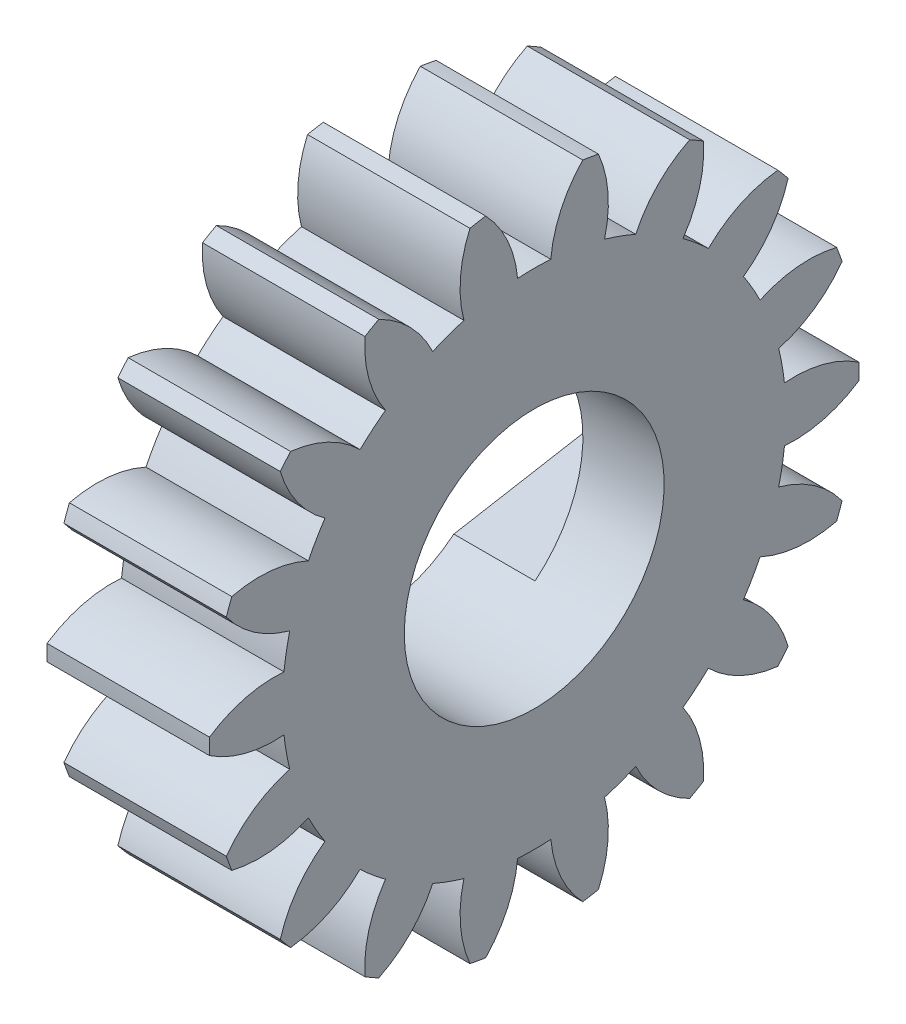
from build123d import *

# Parameters (mm, degrees)
BASPROSKE_W         = 5
BASPROSKE_H         = 10
TOOTHCUT_DEPTH      = 16
TEETHCUTS_COUNT     = 18
TEETHCUTS_ANGLE     = 340
BORSKE_R            = 4
BORE_DEPTH          = 50.0000508
CUT_EXTRUDE_1_DEPTH = 2.5


with BuildPart() as part:
    # BasProSke → Base-Revolve (revolve)
    with BuildSketch(Plane(origin=(0, 0, 0), x_dir=(1, 0, 0), z_dir=(0, 1, 0)), mode=Mode.PRIVATE) as base_revolve_sk:
        with Locations((2.5, 5)):
            Rectangle(BASPROSKE_W, BASPROSKE_H)
    revolve(base_revolve_sk.sketch.rotate(Axis((-10, 0, 0), (1, 0, 0)), 180), axis=Axis((-10, 0, 0), (1, 0, 0)))

    # TooCutSke → ToothCut (cut, through all)
    with BuildSketch(Plane(origin=(0, 0, 0), x_dir=(0, 0, -1), z_dir=(1, 0, 0))):
        with BuildLine():
            ThreePointArc((0.510641536, 7.732156635), (0, 7.749), (-0.510641536, 7.732156635))
            ThreePointArc((-0.510641536, 7.732156635), (-0.82619259, 8.907320741), (-1.515208602, 9.910236529))
            ThreePointArc((-1.515208602, 9.910236529), (0, 10.0254), (1.515208602, 9.910236529))
            ThreePointArc((1.515208602, 9.910236529), (0.82619259, 8.907320741), (0.510641536, 7.732156635))
        make_face()
    toothcut = extrude(amount=TOOTHCUT_DEPTH, mode=Mode.SUBTRACT)

    # TeethCuts: ToothCut ×18 about axis
    teethcuts_axis = Axis((-10, 0, 0), (1, 0, 0))
    for i in range(1, TEETHCUTS_COUNT):
        add(toothcut.rotate(teethcuts_axis, i * TEETHCUTS_ANGLE / (TEETHCUTS_COUNT - 1)), mode=Mode.SUBTRACT)

    # BorSke → Bore (cut, symmetric)
    with BuildSketch(Plane(origin=(0, 0, 0), x_dir=(0, 0, -1), z_dir=(1, 0, 0))):
        with Locations(Location((0, 0, 0), (0, 0, 180))):
            Circle(BORSKE_R)
    extrude(amount=BORE_DEPTH, both=True, mode=Mode.SUBTRACT)

    # 草图2 → 切除-拉伸1 (cut)
    with BuildSketch(Plane.ZY):
        Polygon((0.391153716, 3.478074003), (-0.822007108, -3.402102925), (-15.361721341, -0.838359014), (-14.148560516, 6.041817914), align=None)
    extrude(amount=-CUT_EXTRUDE_1_DEPTH, mode=Mode.SUBTRACT)


solid = part.part
